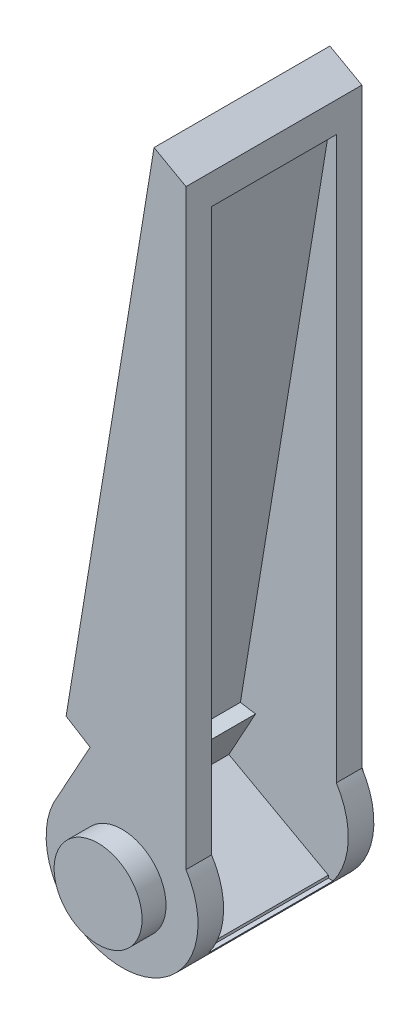
from build123d import *

# Parameters (mm, degrees)
BOSS_EXTRU_1_DEPTH      = 11
ESQUISSE2_R             = 2.75
BOSS_EXTRU_2_DEPTH      = 1.5
BOSS_EXTRU_3_START      = 1.5
ESQUISSE3_R             = 2.75
BOSS_EXTRU_3_DEPTH      = 1.5
ESQUISSE5_W             = 7.8
ESQUISSE5_H             = 40.529247283
ENL_V_MAT_EXTRU_1_DEPTH = 10.5
ESQUISSE6_W             = 7.8
ESQUISSE6_H             = 5
ENL_V_MAT_EXTRU_2_DEPTH = 8
ESQUISSE7_W             = 7.8
ESQUISSE7_H             = 34.280292999
ENL_V_MAT_EXTRU_3_DEPTH = 8


with BuildPart() as part:
    # Esquisse1 → Boss.-Extru.1 (new body)
    with BuildSketch(Plane.XY):
        with BuildLine():
            Line((4, 2.561737691), (4, 39.561737691))
            Line((4, 39.561737691), (2, 40.679247283))
            Line((2, 40.679247283), (-3.5, 7.127049143))
            Line((-3.5, 7.127049143), (-2, 6.193131027))
            Line((-2, 6.193131027), (-4, 2.561737691))
            ThreePointArc((-4, 2.561737691), (0, -4.75), (4, 2.561737691))
        make_face()
    extrude(amount=BOSS_EXTRU_1_DEPTH)

    # Esquisse2 → Boss.-Extru.2 (add)
    with BuildSketch(Plane.XY):
        Circle(ESQUISSE2_R)
    extrude(amount=-BOSS_EXTRU_2_DEPTH)

    # Esquisse3 → Boss.-Extru.3 (add)
    with BuildSketch(Plane.XY.offset(11).offset(BOSS_EXTRU_3_START)):
        Circle(ESQUISSE3_R)
    extrude(amount=-BOSS_EXTRU_3_DEPTH)

    # Esquisse5 → Enlèv. mat.-Extru.1 (cut)
    with BuildSketch(Plane(origin=(14, 0, 0), x_dir=(0, 0, -1), z_dir=(1, 0, 0))):
        with Locations((-5.5, 17.414623642)):
            Rectangle(ESQUISSE5_W, ESQUISSE5_H)
    extrude(amount=-ENL_V_MAT_EXTRU_1_DEPTH, mode=Mode.SUBTRACT)

    # Esquisse6 → Enlèv. mat.-Extru.2 (cut)
    with BuildSketch(Plane(origin=(4.607784726, -2.537750279, 0), x_dir=(0, 0, 1), z_dir=(-0.8759373234553582, 0.4824249220115637, 0))):
        with Locations((5.5, 1.836793332)):
            Rectangle(ESQUISSE6_W, ESQUISSE6_H)
    extrude(amount=ENL_V_MAT_EXTRU_2_DEPTH, mode=Mode.SUBTRACT)

    # Esquisse7 → Enlèv. mat.-Extru.3 (cut)
    with BuildSketch(Plane(origin=(5.322160432, -0.872428157, 0), x_dir=(0, 0, 1), z_dir=(-0.986829357047507, 0.16176470588235298, 0))):
        with Locations((5.5, 20.689899695)):
            Rectangle(ESQUISSE7_W, ESQUISSE7_H)
    extrude(amount=ENL_V_MAT_EXTRU_3_DEPTH, mode=Mode.SUBTRACT)


solid = part.part
